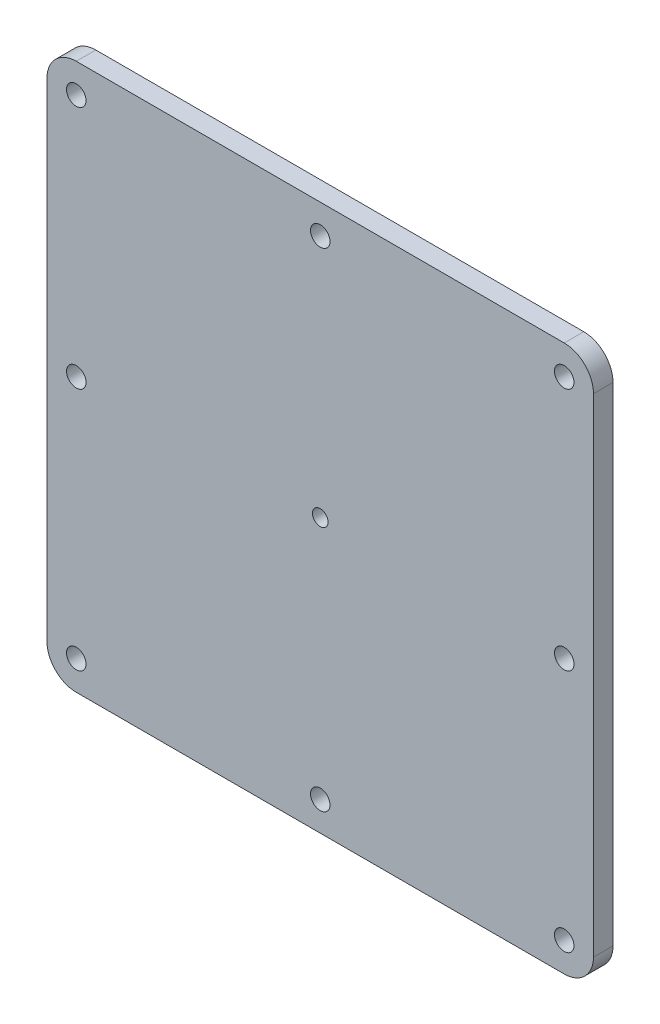
from build123d import *

# Parameters (mm, degrees)
SKETCH2_R           = 5
SKETCH2_R_2         = 4
BOSS_EXTRUDE1_DEPTH = 10


with BuildPart() as part:
    # Sketch2 → Boss-Extrude1 (new body)
    with BuildSketch(Plane.XY):
        with BuildLine():
            Line((-125, 140), (125, 140))
            ThreePointArc((125, 140), (135.606601718, 135.606601718), (140, 125))
            Line((140, 125), (140, -125))
            ThreePointArc((140, -125), (135.606601718, -135.606601718), (125, -140))
            Line((125, -140), (-125, -140))
            ThreePointArc((-125, -140), (-135.606601718, -135.606601718), (-140, -125))
            Line((-140, -125), (-140, 125))
            ThreePointArc((-140, 125), (-135.606601718, 135.606601718), (-125, 140))
        make_face()
        with Locations((-125, 125)):
            Circle(SKETCH2_R, mode=Mode.SUBTRACT)
        with Locations((0, 125)):
            Circle(SKETCH2_R, mode=Mode.SUBTRACT)
        with Locations((125, 125)):
            Circle(SKETCH2_R, mode=Mode.SUBTRACT)
        Circle(SKETCH2_R_2, mode=Mode.SUBTRACT)
        with Locations((125, 0)):
            Circle(SKETCH2_R, mode=Mode.SUBTRACT)
        with Locations((-125, 0)):
            Circle(SKETCH2_R, mode=Mode.SUBTRACT)
        with Locations((-125, -125)):
            Circle(SKETCH2_R, mode=Mode.SUBTRACT)
        with Locations((0, -125)):
            Circle(SKETCH2_R, mode=Mode.SUBTRACT)
        with Locations((125, -125)):
            Circle(SKETCH2_R, mode=Mode.SUBTRACT)
    extrude(amount=BOSS_EXTRUDE1_DEPTH)


solid = part.part
